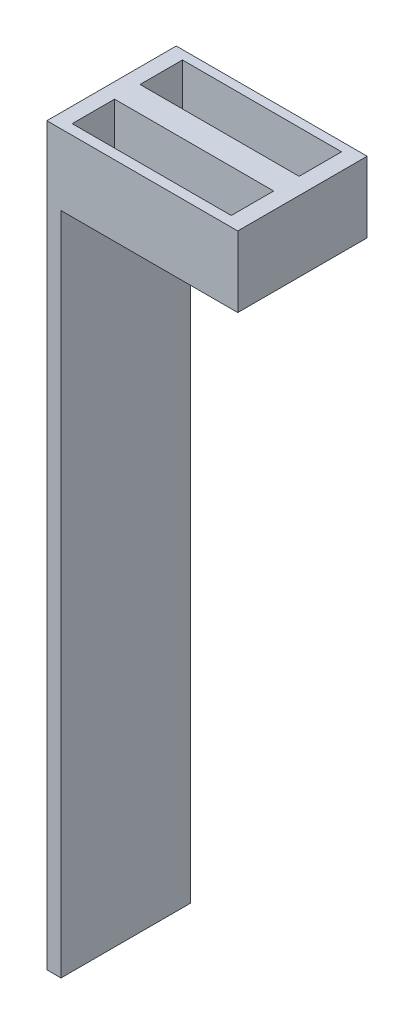
from build123d import *

# Parameters (mm, degrees)
SKETCH_1_W          = 27
SKETCH_1_H          = 18.3
EXTRUDE_1_DEPTH     = 10
SKETCH_2_W          = 22.5
SKETCH_2_H          = 6
CUT_EXTRUDE_1_DEPTH = 10
SKETCH_3_W          = 2
SKETCH_3_H          = 18.3
EXTRUDE_2_DEPTH     = 94


with BuildPart() as part:
    # 草图1 → 凸台-拉伸1 (new body)
    with BuildSketch(Plane(origin=(0, 0, 0), x_dir=(1, 0, 0), z_dir=(0, 1, 0))):
        Rectangle(SKETCH_1_W, SKETCH_1_H)
    extrude(amount=EXTRUDE_1_DEPTH)

    # 草图2 → 切除-拉伸1 (cut)
    with BuildSketch(Plane.XZ):
        with Locations((-0.1, -4.88)):
            Rectangle(SKETCH_2_W, SKETCH_2_H)
        with Locations((-0.1, 4.72)):
            Rectangle(SKETCH_2_W, SKETCH_2_H)
    extrude(amount=-CUT_EXTRUDE_1_DEPTH, mode=Mode.SUBTRACT)

    # 草图3 → 凸台-拉伸2 (add)
    with BuildSketch(Plane.XZ):
        with Locations((-12.5, 0)):
            Rectangle(SKETCH_3_W, SKETCH_3_H)
    extrude(amount=EXTRUDE_2_DEPTH)


solid = part.part
